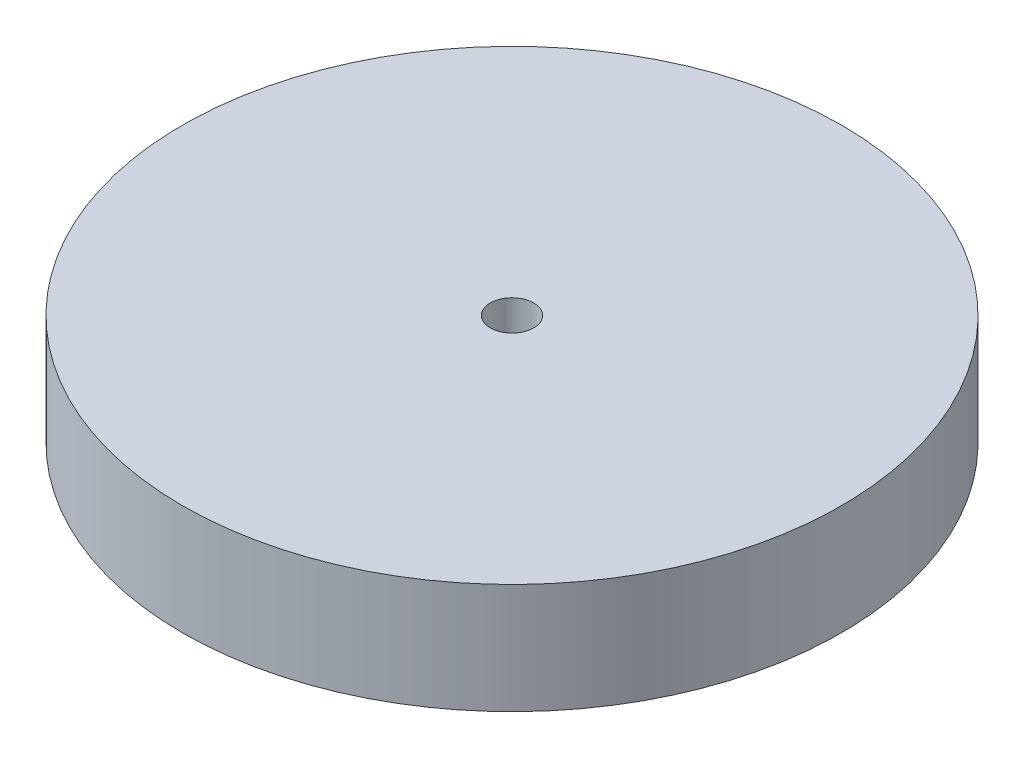
from build123d import *

# Parameters (mm, degrees)
SKETCH1_R           = 38
SKETCH1_R_2         = 2.5
BOSS_EXTRUDE1_DEPTH = 6.35


with BuildPart() as part:
    # Sketch1 → Boss-Extrude1 (new, symmetric)
    with BuildSketch(Plane(origin=(0, 0, 0), x_dir=(1, 0, 0), z_dir=(0, 1, 0))):
        with Locations(Location((0, 0, 0), (0, 0, 270))):
            Circle(SKETCH1_R)
        with Locations(Location((0, 0, 0), (0, 0, 270))):
            Circle(SKETCH1_R_2, mode=Mode.SUBTRACT)
    extrude(amount=BOSS_EXTRUDE1_DEPTH, both=True)


solid = part.part
